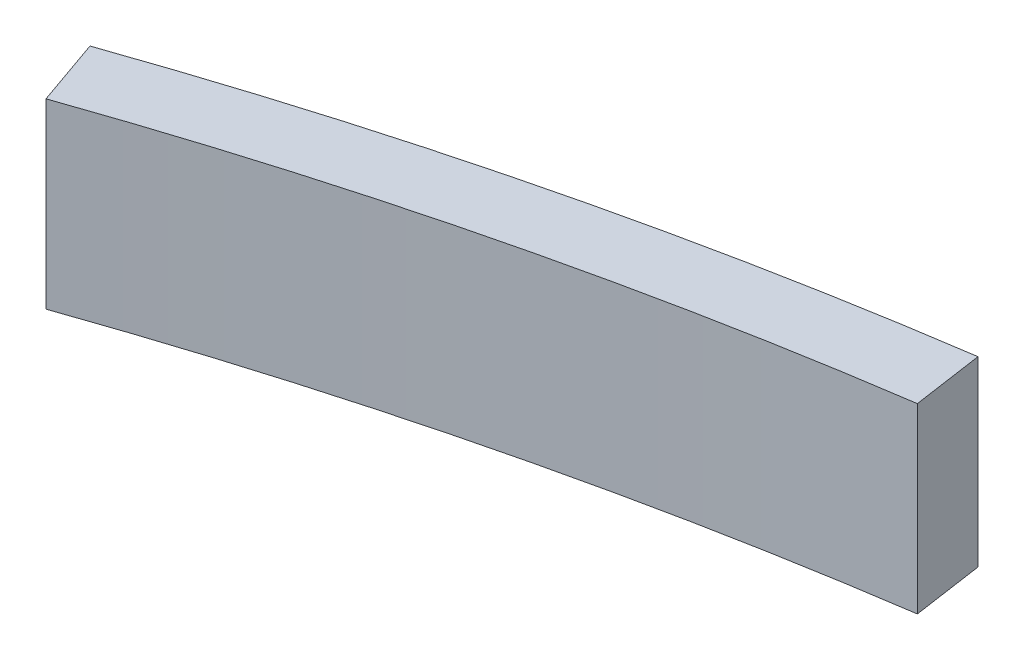
from build123d import *

# Parameters (mm, degrees)
BOSS_EXTRUDE1_DEPTH = 25.4


with BuildPart() as part:
    # Sketch1 → Boss-Extrude1 (new body)
    with BuildSketch(Plane(origin=(0, 0, 0), x_dir=(1, 0, 0), z_dir=(0, 1, 0))):
        with BuildLine():
            Line((-173.091063389, 494.586174266), (-176.394327958, 504.024841713))
            ThreePointArc((-176.394327958, 504.024841713), (-127.27360322, 518.611058428), (-76.980993637, 528.422110267))
            Line((-76.980993637, 528.422110267), (-75.539401996, 518.526565131))
            ThreePointArc((-75.539401996, 518.526565131), (-124.890202411, 508.899240854), (-173.091063389, 494.586174266))
        make_face()
    extrude(amount=BOSS_EXTRUDE1_DEPTH)


solid = part.part
